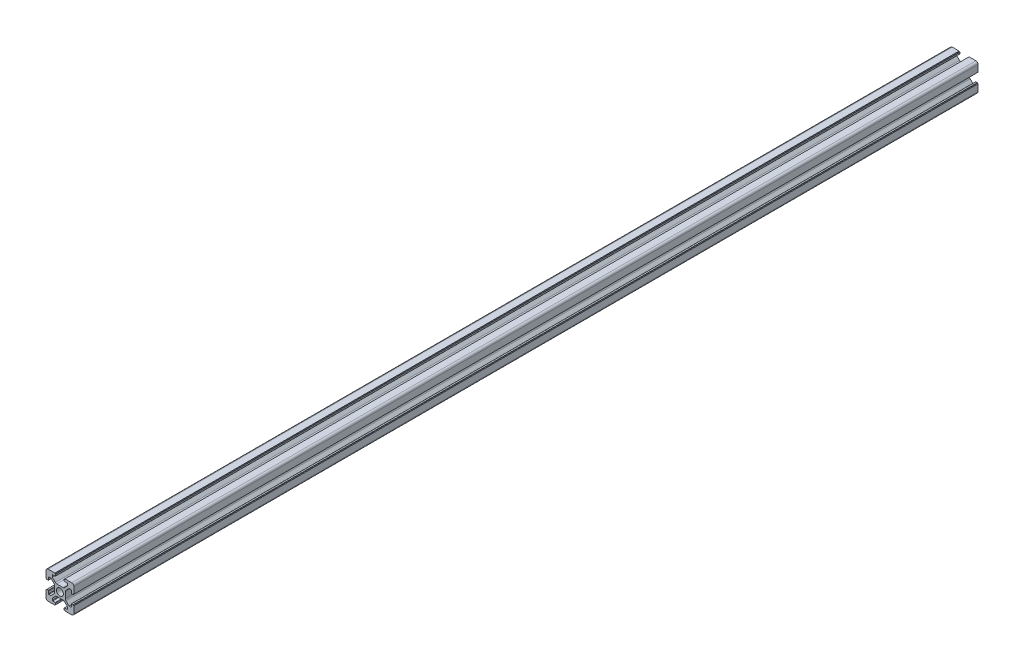
from build123d import *

# Parameters (mm, degrees)
SKETCH_1_R      = 2.5
EXTRUDE_1_DEPTH = 650


with BuildPart() as part:
    # 草图1 → 凸台-拉伸1 (new body)
    with BuildSketch(Plane.XY):
        with BuildLine():
            Line((4.215995631, 3.244230202), (6.436655803, 5.464890373))
            Line((6.436655803, 5.464890373), (7.776655803, 5.464890373))
            ThreePointArc((7.776655803, 5.464890373), (7.988787838, 5.377022408), (8.076655803, 5.164890373))
            Line((8.076655803, 5.164890373), (8.076655803, 3.364890373))
            ThreePointArc((8.076655803, 3.364890373), (8.164523769, 3.152758339), (8.376655803, 3.064890373))
            Line((8.376655803, 3.064890373), (9.376655803, 3.064890373))
            Line((9.376655803, 3.064890373), (9.376655803, 3.364890373))
            ThreePointArc((9.376655803, 3.364890373), (9.435234447, 3.50631173), (9.576655803, 3.564890373))
            Line((9.576655803, 3.564890373), (9.876655803, 3.564890373))
            Line((9.876655803, 3.564890373), (9.876655803, 8.464890373))
            ThreePointArc((9.876655803, 8.464890373), (9.437315975, 9.525550545), (8.376655803, 9.964890373))
            Line((8.376655803, 9.964890373), (3.476655803, 9.964890373))
            Line((3.476655803, 9.964890373), (3.476655803, 9.664890373))
            ThreePointArc((3.476655803, 9.664890373), (3.418077159, 9.523469017), (3.276655803, 9.464890373))
            Line((3.276655803, 9.464890373), (2.976655803, 9.464890373))
            Line((2.976655803, 9.464890373), (2.976655803, 8.464890373))
            ThreePointArc((2.976655803, 8.464890373), (3.064523769, 8.252758339), (3.276655803, 8.164890373))
            Line((3.276655803, 8.164890373), (5.076655803, 8.164890373))
            ThreePointArc((5.076655803, 8.164890373), (5.288787838, 8.077022408), (5.376655803, 7.864890373))
            Line((5.376655803, 7.864890373), (5.376655803, 6.524890373))
            Line((5.376655803, 6.524890373), (3.155995631, 4.304230202))
            ThreePointArc((3.155995631, 4.304230202), (2.669360608, 3.979071075), (2.09533546, 3.864890373))
            Line((2.09533546, 3.864890373), (-2.342023853, 3.864890373))
            ThreePointArc((-2.342023853, 3.864890373), (-2.916049002, 3.979071075), (-3.402684025, 4.304230202))
            Line((-3.402684025, 4.304230202), (-5.623344197, 6.524890373))
            Line((-5.623344197, 6.524890373), (-5.623344197, 7.864890373))
            ThreePointArc((-5.623344197, 7.864890373), (-5.535476231, 8.077022408), (-5.323344197, 8.164890373))
            Line((-5.323344197, 8.164890373), (-3.523344197, 8.164890373))
            ThreePointArc((-3.523344197, 8.164890373), (-3.311212162, 8.252758339), (-3.223344197, 8.464890373))
            Line((-3.223344197, 8.464890373), (-3.223344197, 9.464890373))
            Line((-3.223344197, 9.464890373), (-3.523344197, 9.464890373))
            ThreePointArc((-3.523344197, 9.464890373), (-3.664765553, 9.523469017), (-3.723344197, 9.664890373))
            Line((-3.723344197, 9.664890373), (-3.723344197, 9.964890373))
            Line((-3.723344197, 9.964890373), (-8.623344197, 9.964890373))
            ThreePointArc((-8.623344197, 9.964890373), (-9.684004369, 9.525550545), (-10.123344197, 8.464890373))
            Line((-10.123344197, 8.464890373), (-10.123344197, 3.564890373))
            Line((-10.123344197, 3.564890373), (-9.823344197, 3.564890373))
            ThreePointArc((-9.823344197, 3.564890373), (-9.681922841, 3.50631173), (-9.623344197, 3.364890373))
            Line((-9.623344197, 3.364890373), (-9.623344197, 3.064890373))
            Line((-9.623344197, 3.064890373), (-8.623344197, 3.064890373))
            ThreePointArc((-8.623344197, 3.064890373), (-8.411212162, 3.152758339), (-8.323344197, 3.364890373))
            Line((-8.323344197, 3.364890373), (-8.323344197, 5.164890373))
            ThreePointArc((-8.323344197, 5.164890373), (-8.235476231, 5.377022408), (-8.023344197, 5.464890373))
            Line((-8.023344197, 5.464890373), (-6.683344197, 5.464890373))
            Line((-6.683344197, 5.464890373), (-4.462684025, 3.244230202))
            ThreePointArc((-4.462684025, 3.244230202), (-4.137524898, 2.757595178), (-4.023344197, 2.18357003))
            Line((-4.023344197, 2.18357003), (-4.023344197, -2.253789283))
            ThreePointArc((-4.023344197, -2.253789283), (-4.137524898, -2.827814432), (-4.462684025, -3.314449455))
            Line((-4.462684025, -3.314449455), (-6.683344197, -5.535109627))
            Line((-6.683344197, -5.535109627), (-8.023344197, -5.535109627))
            ThreePointArc((-8.023344197, -5.535109627), (-8.235476231, -5.447241661), (-8.323344197, -5.235109627))
            Line((-8.323344197, -5.235109627), (-8.323344197, -3.435109627))
            ThreePointArc((-8.323344197, -3.435109627), (-8.411212162, -3.222977592), (-8.623344197, -3.135109627))
            Line((-8.623344197, -3.135109627), (-9.623344197, -3.135109627))
            Line((-9.623344197, -3.135109627), (-9.623344197, -3.435109627))
            ThreePointArc((-9.623344197, -3.435109627), (-9.681922841, -3.576530983), (-9.823344197, -3.635109627))
            Line((-9.823344197, -3.635109627), (-10.123344197, -3.635109627))
            Line((-10.123344197, -3.635109627), (-10.123344197, -8.535109627))
            ThreePointArc((-10.123344197, -8.535109627), (-9.684004369, -9.595769798), (-8.623344197, -10.035109627))
            Line((-8.623344197, -10.035109627), (-3.723344197, -10.035109627))
            Line((-3.723344197, -10.035109627), (-3.723344197, -9.735109627))
            ThreePointArc((-3.723344197, -9.735109627), (-3.664765553, -9.59368827), (-3.523344197, -9.535109627))
            Line((-3.523344197, -9.535109627), (-3.223344197, -9.535109627))
            Line((-3.223344197, -9.535109627), (-3.223344197, -8.535109627))
            ThreePointArc((-3.223344197, -8.535109627), (-3.311212162, -8.322977592), (-3.523344197, -8.235109627))
            Line((-3.523344197, -8.235109627), (-5.323344197, -8.235109627))
            ThreePointArc((-5.323344197, -8.235109627), (-5.535476231, -8.147241661), (-5.623344197, -7.935109627))
            Line((-5.623344197, -7.935109627), (-5.623344197, -6.595109627))
            Line((-5.623344197, -6.595109627), (-3.402684025, -4.374449455))
            ThreePointArc((-3.402684025, -4.374449455), (-2.916049002, -4.049290328), (-2.342023853, -3.935109627))
            Line((-2.342023853, -3.935109627), (2.09533546, -3.935109627))
            ThreePointArc((2.09533546, -3.935109627), (2.669360608, -4.049290328), (3.155995631, -4.374449455))
            Line((3.155995631, -4.374449455), (5.376655803, -6.595109627))
            Line((5.376655803, -6.595109627), (5.376655803, -7.935109627))
            ThreePointArc((5.376655803, -7.935109627), (5.288787838, -8.147241661), (5.076655803, -8.235109627))
            Line((5.076655803, -8.235109627), (3.276655803, -8.235109627))
            ThreePointArc((3.276655803, -8.235109627), (3.064523769, -8.322977592), (2.976655803, -8.535109627))
            Line((2.976655803, -8.535109627), (2.976655803, -9.535109627))
            Line((2.976655803, -9.535109627), (3.276655803, -9.535109627))
            ThreePointArc((3.276655803, -9.535109627), (3.418077159, -9.59368827), (3.476655803, -9.735109627))
            Line((3.476655803, -9.735109627), (3.476655803, -10.035109627))
            Line((3.476655803, -10.035109627), (8.376655803, -10.035109627))
            ThreePointArc((8.376655803, -10.035109627), (9.437315975, -9.595769798), (9.876655803, -8.535109627))
            Line((9.876655803, -8.535109627), (9.876655803, -3.635109627))
            Line((9.876655803, -3.635109627), (9.576655803, -3.635109627))
            ThreePointArc((9.576655803, -3.635109627), (9.435234447, -3.576530983), (9.376655803, -3.435109627))
            Line((9.376655803, -3.435109627), (9.376655803, -3.135109627))
            Line((9.376655803, -3.135109627), (8.376655803, -3.135109627))
            ThreePointArc((8.376655803, -3.135109627), (8.164523769, -3.222977592), (8.076655803, -3.435109627))
            Line((8.076655803, -3.435109627), (8.076655803, -5.235109627))
            ThreePointArc((8.076655803, -5.235109627), (7.988787838, -5.447241661), (7.776655803, -5.535109627))
            Line((7.776655803, -5.535109627), (6.436655803, -5.535109627))
            Line((6.436655803, -5.535109627), (4.215995631, -3.314449455))
            ThreePointArc((4.215995631, -3.314449455), (3.890836504, -2.827814432), (3.776655803, -2.253789283))
            Line((3.776655803, -2.253789283), (3.776655803, 2.18357003))
            ThreePointArc((3.776655803, 2.18357003), (3.890836504, 2.757595178), (4.215995631, 3.244230202))
        make_face()
        with Locations((-0.123344197, -0.035109627)):
            Circle(SKETCH_1_R, mode=Mode.SUBTRACT)
    extrude(amount=EXTRUDE_1_DEPTH)


solid = part.part
